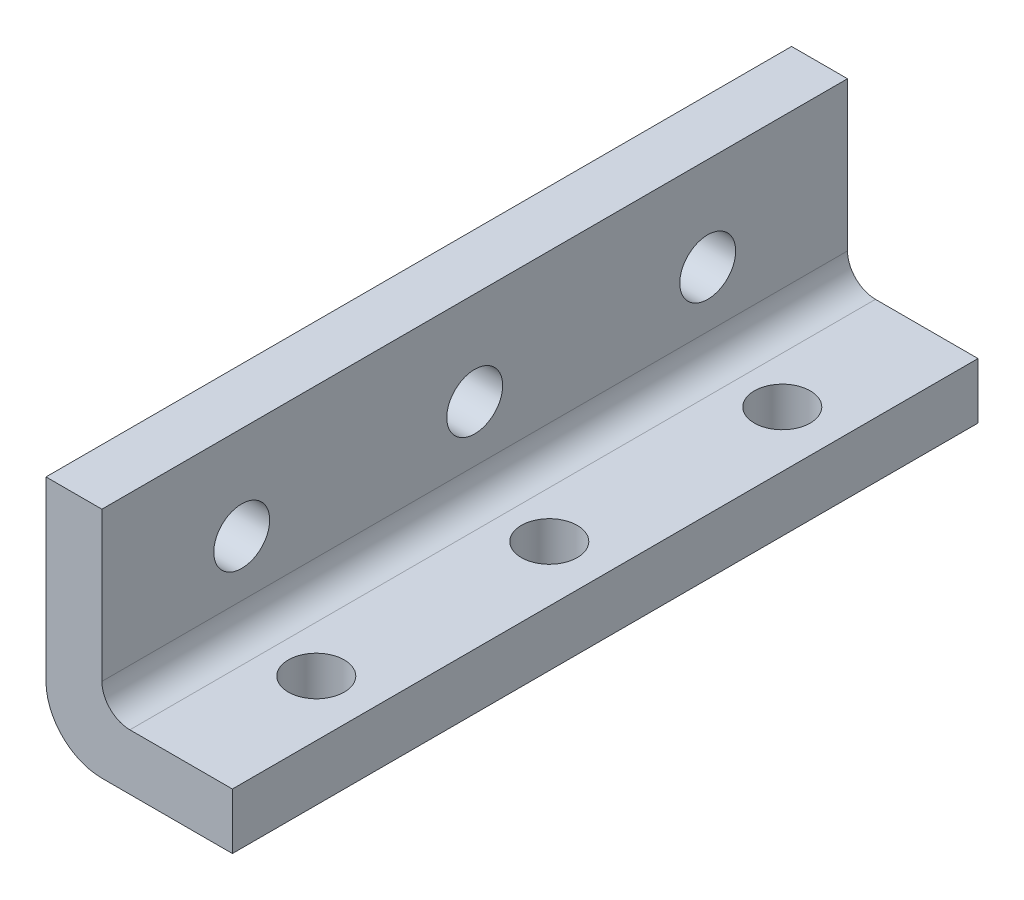
from build123d import *

# Parameters (mm, degrees)
EXTRUDE_1_DEPTH     = 80
SKETCH_2_R          = 3
CUT_EXTRUDE_1_DEPTH = 85.976467331
SKETCH_3_R          = 3
CUT_EXTRUDE_2_DEPTH = 85.622691992
FILLET_1_R          = 6
FILLET_3_R          = 3


with BuildPart() as part:
    # 草图1 → 凸台-拉伸1 (new body)
    with BuildSketch(Plane.XY):
        Polygon((0, 0), (6, 0), (6, -19), (20, -19), (20, -25), (0, -25), align=None)
    extrude(amount=EXTRUDE_1_DEPTH)

    # 草图2 → 切除-拉伸1 (cut, through all)
    with BuildSketch(Plane(origin=(6, 0, 0), x_dir=(0, 0, -1), z_dir=(1, 0, 0))):
        with Locations(Location((-65, -10, 0), (0, 0, 90))):
            Circle(SKETCH_2_R)
        with Locations(Location((-15, -10, 0), (0, 0, 90))):
            Circle(SKETCH_2_R)
        with Locations(Location((-40, -10, 0), (0, 0, 90))):
            Circle(SKETCH_2_R)
    extrude(amount=-CUT_EXTRUDE_1_DEPTH, mode=Mode.SUBTRACT)

    # 草图3 → 切除-拉伸2 (cut, through all)
    with BuildSketch(Plane(origin=(0, -19, 0), x_dir=(1, 0, 0), z_dir=(0, 1, 0))):
        with Locations(Location((14, -15, 0), (0, 0, 270))):
            Circle(SKETCH_3_R)
        with Locations(Location((14, -65, 0), (0, 0, 270))):
            Circle(SKETCH_3_R)
        with Locations(Location((14, -40, 0), (0, 0, 270))):
            Circle(SKETCH_3_R)
    extrude(amount=-CUT_EXTRUDE_2_DEPTH, mode=Mode.SUBTRACT)

    # 圆角1
    fillet_1_edges = [part.edges().sort_by_distance(p)[0] for p in [
        (0, -25, 40),
    ]]
    fillet(fillet_1_edges, radius=FILLET_1_R)

    # 圆角3
    fillet_3_edges = [part.edges().sort_by_distance(p)[0] for p in [
        (6, -19, 40),
    ]]
    fillet(fillet_3_edges, radius=FILLET_3_R)


solid = part.part
